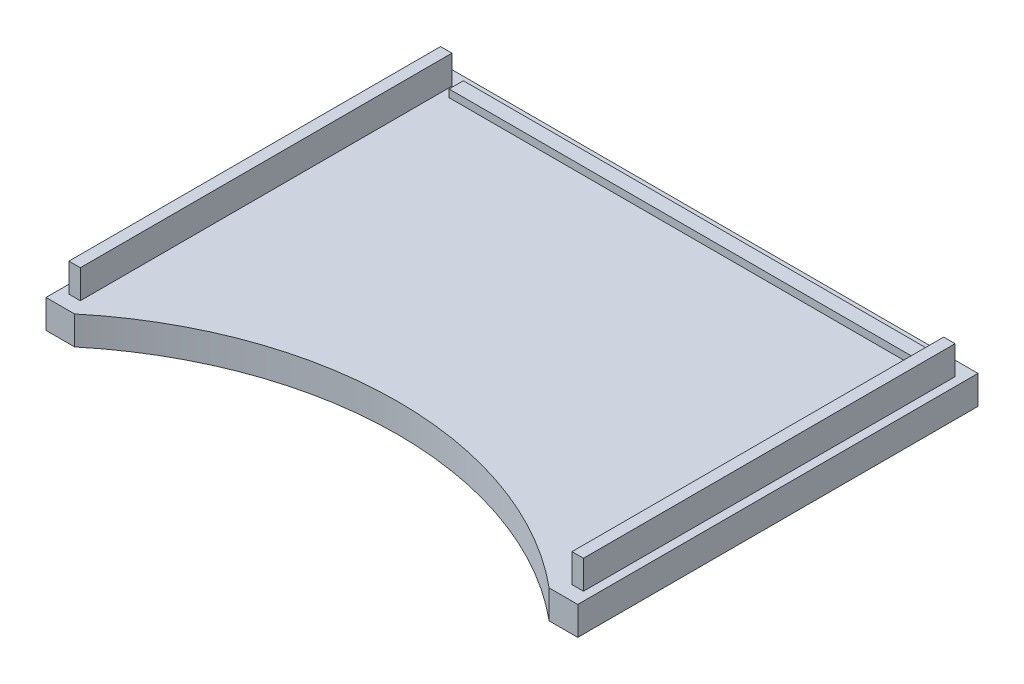
from build123d import *

# Parameters (mm, degrees)
SKETCH1_W           = 186
SKETCH1_H           = 140
BOSS_EXTRUDE1_DEPTH = 10
CUT_EXTRUDE5_DEPTH  = 234.015020975
SKETCH4_W           = 166
SKETCH4_H           = 5
BOSS_EXTRUDE3_DEPTH = 2.6416
SKETCH6_W           = 4
SKETCH6_H           = 130
BOSS_EXTRUDE4_DEPTH = 10
SKETCH7_W           = 4
SKETCH7_H           = 130
BOSS_EXTRUDE5_DEPTH = 10


with BuildPart() as part:
    # Sketch1 → Boss-Extrude1 (new body)
    with BuildSketch(Plane(origin=(0, 0, 0), x_dir=(1, 0, 0), z_dir=(0, 1, 0))):
        with Locations((93, 70)):
            Rectangle(SKETCH1_W, SKETCH1_H)
    extrude(amount=BOSS_EXTRUDE1_DEPTH)

    # Sketch5 → Cut-Extrude5 (cut, through all)
    with BuildSketch(Plane(origin=(0, 10, 0), x_dir=(1, 0, 0), z_dir=(0, 1, 0))):
        with BuildLine():
            Line((176, 0), (10, 0))
            ThreePointArc((10, 0), (93, 30), (176, 0))
        make_face()
    extrude(amount=-CUT_EXTRUDE5_DEPTH, mode=Mode.SUBTRACT)

    # Sketch4 → Boss-Extrude3 (add)
    with BuildSketch(Plane(origin=(0, 10, 0), x_dir=(1, 0, 0), z_dir=(0, 1, 0))):
        with Locations((93, 133.5)):
            Rectangle(SKETCH4_W, SKETCH4_H)
    extrude(amount=BOSS_EXTRUDE3_DEPTH)

    # Sketch6 → Boss-Extrude4 (add)
    with BuildSketch(Plane(origin=(0, 10, 0), x_dir=(1, 0, 0), z_dir=(0, 1, 0))):
        with Locations((181, 70)):
            Rectangle(SKETCH6_W, SKETCH6_H)
    extrude(amount=BOSS_EXTRUDE4_DEPTH)

    # Sketch7 → Boss-Extrude5 (add)
    with BuildSketch(Plane(origin=(0, 10, 0), x_dir=(1, 0, 0), z_dir=(0, 1, 0))):
        with Locations((5, 70)):
            Rectangle(SKETCH7_W, SKETCH7_H)
    extrude(amount=BOSS_EXTRUDE5_DEPTH)


solid = part.part
